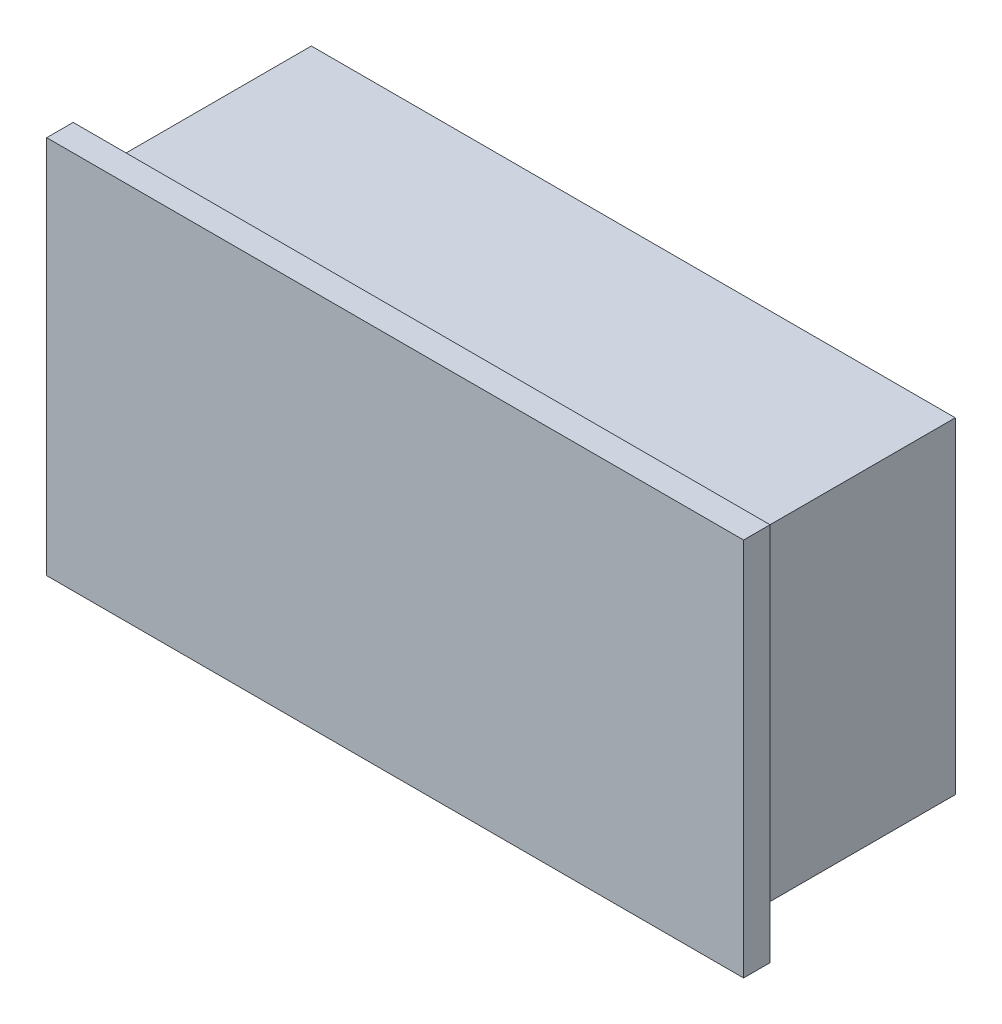
from build123d import *

# Parameters (mm, degrees)
SKIZZE1_W                       = 79
SKIZZE1_H                       = 43
AUFSATZ_LINEAR_AUSTRAGEN1_DEPTH = 27
SKIZZE2_W                       = 79
SKIZZE2_H                       = 43
SKIZZE2_W_2                     = 73
SKIZZE2_H_2                     = 37
SCHNITT_LINEAR_AUSTRAGEN1_DEPTH = 24


with BuildPart() as part:
    # Skizze1 → Aufsatz-Linear austragen1 (new body)
    with BuildSketch(Plane.XY):
        Rectangle(SKIZZE1_W, SKIZZE1_H)
    extrude(amount=AUFSATZ_LINEAR_AUSTRAGEN1_DEPTH)

    # Skizze2 → Schnitt-Linear austragen1 (cut)
    with BuildSketch(Plane(origin=(0, 0, 0), x_dir=(-1, 0, 0), z_dir=(0, 0, -1))):
        Rectangle(SKIZZE2_W, SKIZZE2_H)
        Rectangle(SKIZZE2_W_2, SKIZZE2_H_2, mode=Mode.SUBTRACT)
    extrude(amount=-SCHNITT_LINEAR_AUSTRAGEN1_DEPTH, mode=Mode.SUBTRACT)


solid = part.part
